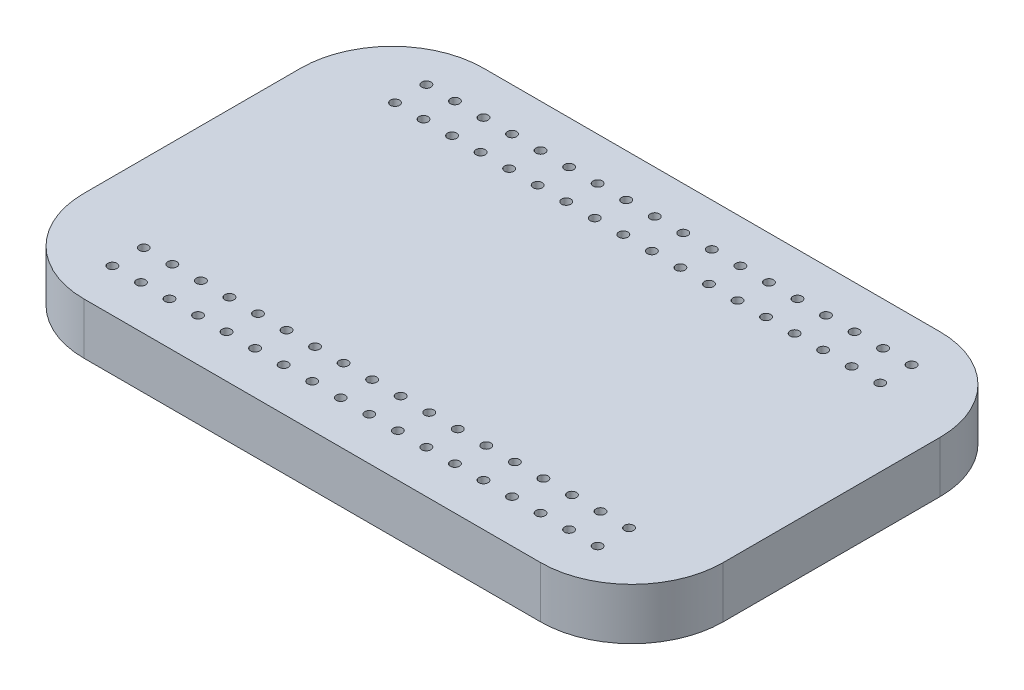
from build123d import *

# Parameters (mm, degrees)
SKETCH1_W           = 56
SKETCH1_H           = 35
BOSS_EXTRUDE1_DEPTH = 2.25
FILLET1_R           = 8
SKETCH2_R           = 0.4
CUT_EXTRUDE1_DEPTH  = 34.324165406
LPATTERN1_COUNT     = 18
LPATTERN1_PITCH     = 2.5


with BuildPart() as part:
    # Sketch1 → Boss-Extrude1 (new, symmetric)
    with BuildSketch(Plane(origin=(0, 0, 0), x_dir=(1, 0, 0), z_dir=(0, 1, 0))):
        Rectangle(SKETCH1_W, SKETCH1_H)
    extrude(amount=BOSS_EXTRUDE1_DEPTH, both=True)

    # Fillet1
    fillet1_edges = [part.edges().sort_by_distance(p)[0] for p in [
        (-28, 0, -17.5),
        (28, 0, -17.5),
        (28, 0, 17.5),
        (-28, 0, 17.5),
    ]]
    fillet(fillet1_edges, radius=FILLET1_R)

    # Sketch2 → Cut-Extrude1 (cut, through all)
    with BuildSketch(Plane(origin=(0, 2.25, 0), x_dir=(1, 0, 0), z_dir=(0, 1, 0))):
        with Locations(Location((21.25, 11, 0), (0, 0, 270))):
            Circle(SKETCH2_R)
        with Locations(Location((21.25, 13.75, 0), (0, 0, 270))):
            Circle(SKETCH2_R)
        with Locations(Location((21.25, -11, 0), (0, 0, 270))):
            Circle(SKETCH2_R)
        with Locations(Location((21.25, -13.75, 0), (0, 0, 270))):
            Circle(SKETCH2_R)
    cut_extrude1 = extrude(amount=-CUT_EXTRUDE1_DEPTH, mode=Mode.SUBTRACT)

    # LPattern1: Cut-Extrude1 ×18
    with Locations(*[(-i * LPATTERN1_PITCH, 0, 0) for i in range(1, LPATTERN1_COUNT)]):
        add(cut_extrude1, mode=Mode.SUBTRACT)


solid = part.part
